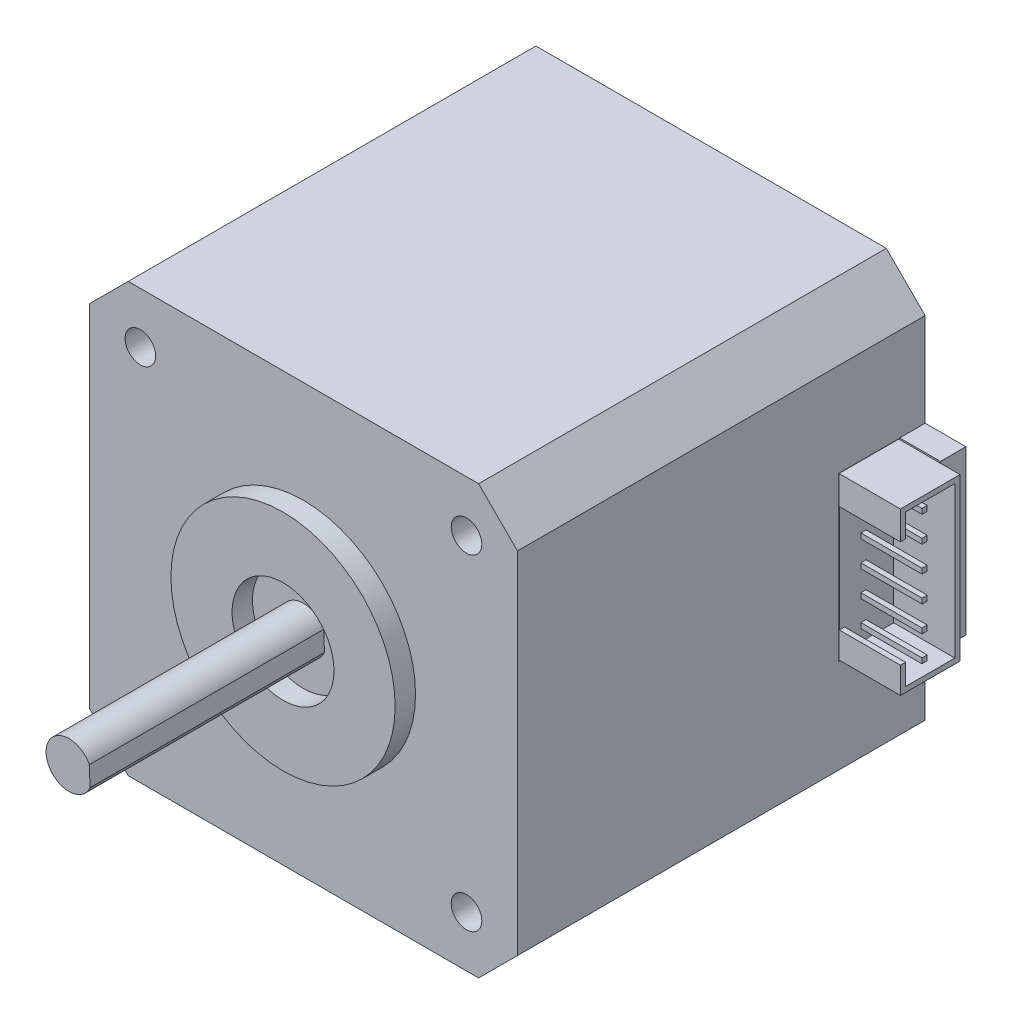
from build123d import *

# Parameters (mm, degrees)
SKETCH1_W           = 42
SKETCH1_H           = 42
BOSS_EXTRUDE1_DEPTH = 40
SKETCH2_R           = 11
SKETCH2_R_2         = 5
BOSS_EXTRUDE2_DEPTH = 2
BOSS_EXTRUDE3_DEPTH = 23
SKETCH4_R           = 1.5
CUT_EXTRUDE1_DEPTH  = 2.68
SKETCH5_R           = 3
CUT_EXTRUDE2_DEPTH  = 2.68
SKETCH6_R           = 5
CUT_EXTRUDE3_DEPTH  = 2.68
SKETCH7_R           = 3.5
SKETCH7_R_2         = 3.4238
SKETCH7_R_3         = 2.5
SKETCH7_R_4         = 2.4238
CUT_EXTRUDE4_DEPTH  = 0.0254
CHAMFER1_SIZE       = 3.81
SKETCH8_W           = 2.5
SKETCH8_H           = 16
BOSS_EXTRUDE4_DEPTH = 4
SKETCH9_W           = 6
SKETCH9_H           = 16
SKETCH9_W_2         = 5.8476
SKETCH9_H_2         = 15.8476
CUT_EXTRUDE5_DEPTH  = 0.0254
SKETCH10_W          = 0.508
SKETCH10_H          = 0.508
BOSS_EXTRUDE5_DEPTH = 6


with BuildPart() as part:
    # Sketch1 → Boss-Extrude1 (new body)
    with BuildSketch(Plane.XY):
        with Locations((21, -21)):
            Rectangle(SKETCH1_W, SKETCH1_H)
    extrude(amount=BOSS_EXTRUDE1_DEPTH)

    # Sketch2 → Boss-Extrude2 (add)
    with BuildSketch(Plane.XY.offset(40)):
        with Locations((21, -21)):
            Circle(SKETCH2_R)
        with Locations((21, -21)):
            Circle(SKETCH2_R_2, mode=Mode.SUBTRACT)
    extrude(amount=BOSS_EXTRUDE2_DEPTH)

    # Sketch3 → Boss-Extrude3 (add)
    with BuildSketch(Plane.XY.offset(40)):
        with BuildLine():
            Line((23.063065241, -21.897920826), (22.998678024, -19.966662613))
            ThreePointArc((22.998678024, -19.966662613), (18.751249422, -21.074972259), (23.063065241, -21.897920826))
        make_face()
    extrude(amount=BOSS_EXTRUDE3_DEPTH)

    # Sketch4 → Cut-Extrude1 (cut)
    with BuildSketch(Plane.XY.offset(40)):
        with Locations((5, -5)):
            Circle(SKETCH4_R)
        with Locations((5, -37)):
            Circle(SKETCH4_R)
        with Locations(Location((37, -5, 0), (0, 0, 180))):
            Circle(SKETCH4_R)
        with Locations(Location((37, -37, 0), (0, 0, 180))):
            Circle(SKETCH4_R)
    extrude(amount=-CUT_EXTRUDE1_DEPTH, mode=Mode.SUBTRACT)

    # Sketch5 → Cut-Extrude2 (cut)
    with BuildSketch(Plane(origin=(0, 0, 0), x_dir=(-1, 0, 0), z_dir=(0, 0, -1))):
        with Locations((-37, -5)):
            Circle(SKETCH5_R)
        with Locations((-37, -37)):
            Circle(SKETCH5_R)
        with Locations(Location((-5, -37, 0), (0, 0, 180))):
            Circle(SKETCH5_R)
        with Locations(Location((-5, -5, 0), (0, 0, 180))):
            Circle(SKETCH5_R)
    extrude(amount=-CUT_EXTRUDE2_DEPTH, mode=Mode.SUBTRACT)

    # Sketch6 → Cut-Extrude3 (cut)
    with BuildSketch(Plane(origin=(0, 0, 0), x_dir=(-1, 0, 0), z_dir=(0, 0, -1))):
        with Locations(Location((-21, -21, 0), (0, 0, 180))):
            Circle(SKETCH6_R)
    extrude(amount=-CUT_EXTRUDE3_DEPTH, mode=Mode.SUBTRACT)

    # Sketch7 → Cut-Extrude4 (cut)
    # profile 1 of 2: a face of its own
    with BuildSketch(Plane(origin=(0, 0, 2.68), x_dir=(-1, 0, 0), z_dir=(0, 0, -1))):
        with Locations((-21, -21)):
            Circle(SKETCH7_R)
        with Locations((-21, -21)):
            Circle(SKETCH7_R_2, mode=Mode.SUBTRACT)
    # profile 2 of 2: a face of its own
    with BuildSketch(Plane(origin=(0, 0, 2.68), x_dir=(-1, 0, 0), z_dir=(0, 0, -1))):
        with Locations((-21, -21)):
            Circle(SKETCH7_R_3)
        with Locations((-21, -21)):
            Circle(SKETCH7_R_4, mode=Mode.SUBTRACT)
    extrude(amount=-CUT_EXTRUDE4_DEPTH, mode=Mode.SUBTRACT)

    # Chamfer1
    chamfer1_edges = [part.edges().sort_by_distance(p)[0] for p in [
        (0, 0, 20),
        (42, 0, 20),
        (42, -42, 20),
        (0, -42, 20),
    ]]
    chamfer(chamfer1_edges, length=CHAMFER1_SIZE)

    # Sketch8 → Boss-Extrude4 (add)
    with BuildSketch(Plane(origin=(42, 0, 0), x_dir=(0, 0, -1), z_dir=(1, 0, 0))):
        with Locations((-1.25, -20.954)):
            Rectangle(SKETCH8_W, SKETCH8_H)
    extrude(amount=BOSS_EXTRUDE4_DEPTH)

    # Sketch9 → Cut-Extrude5 (cut)
    with BuildSketch(Plane(origin=(42, 0, 0), x_dir=(0, 0, -1), z_dir=(1, 0, 0))):
        with Locations((-5.5, -20.954)):
            Rectangle(SKETCH9_W, SKETCH9_H)
        with Locations((-5.5, -20.954)):
            Rectangle(SKETCH9_W_2, SKETCH9_H_2, mode=Mode.SUBTRACT)
    extrude(amount=-CUT_EXTRUDE5_DEPTH, mode=Mode.SUBTRACT)

    # Sketch10 → Boss-Extrude5 (add)
    with BuildSketch(Plane(origin=(42, 0, 0), x_dir=(0, 0, -1), z_dir=(1, 0, 0))):
        Polygon((-7.9158, -28.3698), (-7.9158, -26.311363573), (-8.4238, -26.311363573), (-8.4238, -28.8778), (-2.5762, -28.8778), (-2.5762, -13.0302), (-8.4238, -13.0302), (-8.4238, -15.827398032), (-7.9158, -15.827398032), (-7.9158, -13.5382), (-3.0842, -13.5382), (-3.0842, -28.3698), align=None)
        with Locations((-6.058218613, -24.450923399)):
            Rectangle(SKETCH10_W, SKETCH10_H)
        with Locations((-6.058218613, -26.990923399)):
            Rectangle(SKETCH10_W, SKETCH10_H)
        with Locations((-6.058218613, -21.910923399)):
            Rectangle(SKETCH10_W, SKETCH10_H)
        with Locations((-6.058218613, -19.370923399)):
            Rectangle(SKETCH10_W, SKETCH10_H)
        with Locations((-6.058218613, -16.830923399)):
            Rectangle(SKETCH10_W, SKETCH10_H)
        with Locations((-6.058218613, -14.290923399)):
            Rectangle(SKETCH10_W, SKETCH10_H)
    extrude(amount=BOSS_EXTRUDE5_DEPTH)


solid = part.part
